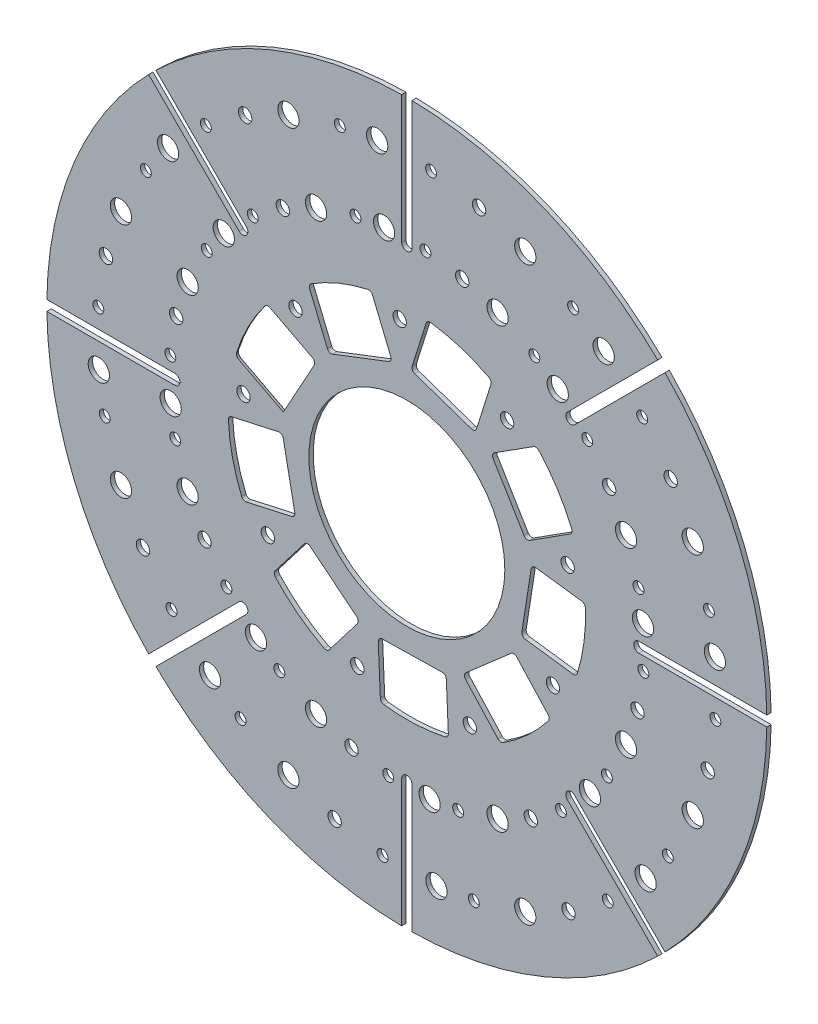
from build123d import *

# Parameters (mm, degrees)
ESBO_O1_R                = 174.5
ESBO_O1_R_2              = 47.5
RESSALTO_EXTRUS_O1_DEPTH = 2.1
ESBO_O3_R                = 5.15
ESBO_O3_R_2              = 2.65
ESBO_O3_R_3              = 3.25
CORTE_EXTRUS_O2_DEPTH    = 247.789201547
CORTE_EXTRUS_O3_DEPTH    = 247.789201547
ESBO_O6_R                = 3.25
CORTE_EXTRUS_O4_DEPTH    = 247.76387499
CORTE_EXTRUS_O5_DEPTH    = 247.76387499
FILETE1_R                = 2


with BuildPart() as part:
    # Esboço1 → Ressalto-extrusão1 (new body)
    with BuildSketch(Plane.XY):
        Circle(ESBO_O1_R)
        Circle(ESBO_O1_R_2, mode=Mode.SUBTRACT)
    extrude(amount=RESSALTO_EXTRUS_O1_DEPTH)

    # Esboço3 → Corte-extrusão2 (cut, through all)
    with BuildSketch(Plane.XY.offset(2.1)):
        with Locations((-138.581929877, 57.402514855)):
            Circle(ESBO_O3_R)
        with Locations((-106.246146239, 44.008594722)):
            Circle(ESBO_O3_R)
        with Locations((-126.508716872, 80.594941252)):
            Circle(ESBO_O3_R_2)
        with Locations((-96.990016268, 61.78945496)):
            Circle(ESBO_O3_R_2)
        with Locations((-115.743687508, 95.411733042)):
            Circle(ESBO_O3_R)
        with Locations((-88.73682709, 73.148995332)):
            Circle(ESBO_O3_R)
        with Locations((-145.85548806, 35.016804578)):
            Circle(ESBO_O3_R_3)
        with Locations((-111.822540846, 26.846216843)):
            Circle(ESBO_O3_R_3)
        with Locations((-114.645493379, 9.022796009)):
            Circle(ESBO_O3_R_2)
        with Locations((-149.53760006, 11.768864359)):
            Circle(ESBO_O3_R_2)
        with Locations((-57.402514855, 138.581929877)):
            Circle(ESBO_O3_R)
        with Locations((-44.008594722, 106.246146239)):
            Circle(ESBO_O3_R)
        with Locations((-32.465942091, 146.444401068)):
            Circle(ESBO_O3_R_2)
        with Locations((-24.890555603, 112.274040819)):
            Circle(ESBO_O3_R_2)
        with Locations((-14.376862878, 149.309429755)):
            Circle(ESBO_O3_R)
        with Locations((-11.02226154, 114.470562812)):
            Circle(ESBO_O3_R)
        with Locations((-78.374784707, 127.896024653)):
            Circle(ESBO_O3_R_3)
        with Locations((-60.087334942, 98.053618901)):
            Circle(ESBO_O3_R_3)
        with Locations((-74.686525558, 87.446686044)):
            Circle(ESBO_O3_R_2)
        with Locations((-97.41720725, 114.06089484)):
            Circle(ESBO_O3_R_2)
        with Locations((57.402514855, 138.581929877)):
            Circle(ESBO_O3_R)
        with Locations((44.008594722, 106.246146239)):
            Circle(ESBO_O3_R)
        with Locations((80.594941252, 126.508716872)):
            Circle(ESBO_O3_R_2)
        with Locations((61.78945496, 96.990016268)):
            Circle(ESBO_O3_R_2)
        with Locations((95.411733042, 115.743687508)):
            Circle(ESBO_O3_R)
        with Locations((73.148995332, 88.73682709)):
            Circle(ESBO_O3_R)
        with Locations((35.016804578, 145.85548806)):
            Circle(ESBO_O3_R_3)
        with Locations((26.846216843, 111.822540846)):
            Circle(ESBO_O3_R_3)
        with Locations((9.022796009, 114.645493379)):
            Circle(ESBO_O3_R_2)
        with Locations((11.768864359, 149.53760006)):
            Circle(ESBO_O3_R_2)
        with Locations((138.581929877, 57.402514855)):
            Circle(ESBO_O3_R)
        with Locations((106.246146239, 44.008594722)):
            Circle(ESBO_O3_R)
        with Locations((146.444401068, 32.465942091)):
            Circle(ESBO_O3_R_2)
        with Locations((112.274040819, 24.890555603)):
            Circle(ESBO_O3_R_2)
        with Locations((149.309429755, 14.376862878)):
            Circle(ESBO_O3_R)
        with Locations((114.470562812, 11.02226154)):
            Circle(ESBO_O3_R)
        with Locations((127.896024653, 78.374784707)):
            Circle(ESBO_O3_R_3)
        with Locations((98.053618901, 60.087334942)):
            Circle(ESBO_O3_R_3)
        with Locations((87.446686044, 74.686525558)):
            Circle(ESBO_O3_R_2)
        with Locations((114.06089484, 97.41720725)):
            Circle(ESBO_O3_R_2)
        with Locations((138.581929877, -57.402514855)):
            Circle(ESBO_O3_R)
        with Locations((106.246146239, -44.008594722)):
            Circle(ESBO_O3_R)
        with Locations((126.508716872, -80.594941252)):
            Circle(ESBO_O3_R_2)
        with Locations((96.990016268, -61.78945496)):
            Circle(ESBO_O3_R_2)
        with Locations((115.743687508, -95.411733042)):
            Circle(ESBO_O3_R)
        with Locations((88.73682709, -73.148995332)):
            Circle(ESBO_O3_R)
        with Locations((145.85548806, -35.016804578)):
            Circle(ESBO_O3_R_3)
        with Locations((111.822540846, -26.846216843)):
            Circle(ESBO_O3_R_3)
        with Locations((114.645493379, -9.022796009)):
            Circle(ESBO_O3_R_2)
        with Locations((149.53760006, -11.768864359)):
            Circle(ESBO_O3_R_2)
        with Locations((57.402514855, -138.581929877)):
            Circle(ESBO_O3_R)
        with Locations((44.008594722, -106.246146239)):
            Circle(ESBO_O3_R)
        with Locations((32.465942091, -146.444401068)):
            Circle(ESBO_O3_R_2)
        with Locations((24.890555603, -112.274040819)):
            Circle(ESBO_O3_R_2)
        with Locations((14.376862878, -149.309429755)):
            Circle(ESBO_O3_R)
        with Locations((11.02226154, -114.470562812)):
            Circle(ESBO_O3_R)
        with Locations((78.374784707, -127.896024653)):
            Circle(ESBO_O3_R_3)
        with Locations((60.087334942, -98.053618901)):
            Circle(ESBO_O3_R_3)
        with Locations((74.686525558, -87.446686044)):
            Circle(ESBO_O3_R_2)
        with Locations((97.41720725, -114.06089484)):
            Circle(ESBO_O3_R_2)
        with Locations((-57.402514855, -138.581929877)):
            Circle(ESBO_O3_R)
        with Locations((-44.008594722, -106.246146239)):
            Circle(ESBO_O3_R)
        with Locations((-80.594941252, -126.508716872)):
            Circle(ESBO_O3_R_2)
        with Locations((-61.78945496, -96.990016268)):
            Circle(ESBO_O3_R_2)
        with Locations((-95.411733042, -115.743687508)):
            Circle(ESBO_O3_R)
        with Locations((-73.148995332, -88.73682709)):
            Circle(ESBO_O3_R)
        with Locations((-35.016804578, -145.85548806)):
            Circle(ESBO_O3_R_3)
        with Locations((-26.846216843, -111.822540846)):
            Circle(ESBO_O3_R_3)
        with Locations((-9.022796009, -114.645493379)):
            Circle(ESBO_O3_R_2)
        with Locations((-11.768864359, -149.53760006)):
            Circle(ESBO_O3_R_2)
        with Locations((-138.581929877, -57.402514855)):
            Circle(ESBO_O3_R)
        with Locations((-106.246146239, -44.008594722)):
            Circle(ESBO_O3_R)
        with Locations((-146.444401068, -32.465942091)):
            Circle(ESBO_O3_R_2)
        with Locations((-112.274040819, -24.890555603)):
            Circle(ESBO_O3_R_2)
        with Locations((-149.309429755, -14.376862878)):
            Circle(ESBO_O3_R)
        with Locations((-114.470562812, -11.02226154)):
            Circle(ESBO_O3_R)
        with Locations((-127.896024653, -78.374784707)):
            Circle(ESBO_O3_R_3)
        with Locations((-98.053618901, -60.087334942)):
            Circle(ESBO_O3_R_3)
        with Locations((-87.446686044, -74.686525558)):
            Circle(ESBO_O3_R_2)
        with Locations((-114.06089484, -97.41720725)):
            Circle(ESBO_O3_R_2)
    extrude(amount=-CORTE_EXTRUS_O2_DEPTH, mode=Mode.SUBTRACT)

    # Esboço2 → Corte-extrusão3 (cut, through all)
    with BuildSketch(Plane.XY.offset(2.1)):
        with BuildLine():
            Line((-2.5, 239.122256025), (2.5, 239.122256025))
            Line((2.5, 239.122256025), (2.5, 112.5))
            ThreePointArc((2.5, 112.5), (0, 110), (-2.5, 112.5))
            Line((-2.5, 112.5), (-2.5, 239.122256025))
        make_face()
        with BuildLine():
            Line((167.317201815, 170.852735721), (170.852735721, 167.317201815))
            Line((170.852735721, 167.317201815), (81.317279836, 77.781745931))
            ThreePointArc((81.317279836, 77.781745931), (77.781745931, 77.781745931), (77.781745931, 81.317279836))
            Line((77.781745931, 81.317279836), (167.317201815, 170.852735721))
        make_face()
        with BuildLine():
            Line((239.122256025, 2.5), (239.122256025, -2.5))
            Line((239.122256025, -2.5), (112.5, -2.5))
            ThreePointArc((112.5, -2.5), (110, 0), (112.5, 2.5))
            Line((112.5, 2.5), (239.122256025, 2.5))
        make_face()
        with BuildLine():
            Line((170.852735721, -167.317201815), (167.317201815, -170.852735721))
            Line((167.317201815, -170.852735721), (77.781745931, -81.317279836))
            ThreePointArc((77.781745931, -81.317279836), (77.781745931, -77.781745931), (81.317279836, -77.781745931))
            Line((81.317279836, -77.781745931), (170.852735721, -167.317201815))
        make_face()
        with BuildLine():
            Line((2.5, -239.122256025), (-2.5, -239.122256025))
            Line((-2.5, -239.122256025), (-2.5, -112.5))
            ThreePointArc((-2.5, -112.5), (0, -110), (2.5, -112.5))
            Line((2.5, -112.5), (2.5, -239.122256025))
        make_face()
        with BuildLine():
            Line((-167.317201815, -170.852735721), (-170.852735721, -167.317201815))
            Line((-170.852735721, -167.317201815), (-81.317279836, -77.781745931))
            ThreePointArc((-81.317279836, -77.781745931), (-77.781745931, -77.781745931), (-77.781745931, -81.317279836))
            Line((-77.781745931, -81.317279836), (-167.317201815, -170.852735721))
        make_face()
        with BuildLine():
            Line((-239.122256025, -2.5), (-239.122256025, 2.5))
            Line((-239.122256025, 2.5), (-112.5, 2.5))
            ThreePointArc((-112.5, 2.5), (-110, 0), (-112.5, -2.5))
            Line((-112.5, -2.5), (-239.122256025, -2.5))
        make_face()
        with BuildLine():
            Line((-170.852735721, 167.317201815), (-167.317201815, 170.852735721))
            Line((-167.317201815, 170.852735721), (-77.781745931, 81.317279836))
            ThreePointArc((-77.781745931, 81.317279836), (-77.781745931, 77.781745931), (-81.317279836, 77.781745931))
            Line((-81.317279836, 77.781745931), (-170.852735721, 167.317201815))
        make_face()
    extrude(amount=-CORTE_EXTRUS_O3_DEPTH, mode=Mode.SUBTRACT)

    # Esboço6 → Corte-extrusão4 (cut, through all)
    with BuildSketch(Plane.XY.offset(2.1)):
        with Locations((-3.483008081, 79.774000493)):
            Circle(ESBO_O6_R)
        with Locations((48.609600106, 63.349264222)):
            Circle(ESBO_O6_R)
        with Locations((77.957236169, 17.282703173)):
            Circle(ESBO_O6_R)
        with Locations((70.827815029, -36.870626767)):
            Circle(ESBO_O6_R)
        with Locations((30.557272074, -73.771780671)):
            Circle(ESBO_O6_R)
        with Locations((-24.01135809, -76.154298517)):
            Circle(ESBO_O6_R)
        with Locations((-67.344806948, -42.903373726)):
            Circle(ESBO_O6_R)
        with Locations((-79.166872181, 10.422516449)):
            Circle(ESBO_O6_R)
        with Locations((-53.945878078, 58.871595344)):
            Circle(ESBO_O6_R)
    extrude(amount=-CORTE_EXTRUS_O4_DEPTH, mode=Mode.SUBTRACT)

    # Esboço7 → Corte-extrusão5 (cut, through all)
    with BuildSketch(Plane.XY.offset(2.1)):
        with BuildLine():
            Line((-37.781699587, 48.109559853), (-6.992261999, 59.984345451))
            Line((-6.992261999, 59.984345451), (-17.294262305, 84.855574309))
            ThreePointArc((-17.294262305, 84.855574309), (-33.140385243, 80.007967515), (-47.773061864, 72.230842167))
            Line((-47.773061864, 72.230842167), (-37.781699587, 48.109559853))
        make_face()
        with BuildLine():
            Line((1.98176796, 61.139669354), (33.200810582, 50.445213884))
            Line((33.200810582, 50.445213884), (41.295938242, 76.119678696))
            ThreePointArc((41.295938242, 76.119678696), (26.041122237, 82.591887935), (9.832801811, 86.039967507))
            Line((9.832801811, 86.039967507), (1.98176796, 61.139669354))
        make_face()
        with BuildLine():
            Line((40.817944254, 45.561848072), (57.858854906, 17.302206104))
            Line((57.858854906, 17.302206104), (80.563310332, 31.766539444))
            ThreePointArc((80.563310332, 31.766539444), (73.037699207, 46.530146083), (62.837788238, 59.590035822))
            Line((62.837788238, 59.590035822), (40.817944254, 45.561848072))
        make_face()
        with BuildLine():
            Line((60.554950791, 8.665131714), (55.44409799, -23.936696204))
            Line((55.44409799, -23.936696204), (82.134214157, -27.450516659))
            ThreePointArc((82.134214157, -27.450516659), (85.859124995, -11.303568246), (86.440275185, 5.257264107))
            Line((86.440275185, 5.257264107), (60.554950791, 8.665131714))
        make_face()
        with BuildLine():
            Line((51.957622859, -32.286096075), (27.086431432, -53.975352332))
            Line((27.086431432, -53.975352332), (45.273606357, -73.823170938))
            ThreePointArc((45.273606357, -73.823170938), (58.50611198, -63.848217368), (69.596396696, -51.535439912))
            Line((69.596396696, -51.535439912), (51.957622859, -32.286096075))
        make_face()
        with BuildLine():
            Line((19.048745747, -58.130300691), (-13.945277425, -58.758341234))
            Line((-13.945277425, -58.758341234), (-12.771025017, -85.653143083))
            ThreePointArc((-12.771025017, -85.653143083), (3.777438946, -86.517575989), (20.187590715, -84.214138843))
            Line((20.187590715, -84.214138843), (19.048745747, -58.130300691))
        make_face()
        with BuildLine():
            Line((-22.773251204, -56.774691567), (-48.45183599, -36.047649247))
            Line((-48.45183599, -36.047649247), (-64.839951852, -57.405057651))
            ThreePointArc((-64.839951852, -57.405057651), (-52.718739752, -68.704399269), (-38.667213321, -77.488106274))
            Line((-38.667213321, -77.488106274), (-22.773251204, -56.774691567))
        make_face()
        with BuildLine():
            Line((-53.93939082, -28.853573279), (-60.287242014, 3.530138448))
            Line((-60.287242014, 3.530138448), (-86.569544599, -2.296507757))
            ThreePointArc((-86.569544599, -2.296507757), (-84.547234217, -18.743670567), (-79.429198507, -34.504527595))
            Line((-79.429198507, -34.504527595), (-53.93939082, -28.853573279))
        make_face()
        with BuildLine():
            Line((-59.866690001, 12.568452618), (-43.91357748, 41.45613513))
            Line((-43.91357748, 41.45613513), (-67.792285315, 53.886603639))
            ThreePointArc((-67.792285315, 53.886603639), (-76.815138153, 39.987429906), (-83.025378954, 24.624103021))
            Line((-83.025378954, 24.624103021), (-59.866690001, 12.568452618))
        make_face()
    extrude(amount=-CORTE_EXTRUS_O5_DEPTH, mode=Mode.SUBTRACT)

    # Filete1
    filete1_edges = [part.edges().sort_by_distance(p)[0] for p in [
        (-71.446034478, 18.59627782, 0),
        (-76.815138153, 39.987429906, 0),
        (-55.852931398, 47.671369384, 0),
        (-22.773251204, -56.774691567, 1.05),
        (-38.667213321, -77.488106274, 1.05),
        (-64.839951852, -57.405057651, 1.05),
        (-48.45183599, -36.047649247, 1.05),
        (20.187590715, -84.214138843, 1.05),
        (-12.771025017, -85.653143083, 1.05),
        (-13.945277425, -58.758341234, 1.05),
        (19.048745747, -58.130300691, 1.05),
        (51.957622859, -32.286096075, 1.05),
        (27.086431432, -53.975352332, 1.05),
        (45.273606357, -73.823170938, 1.05),
        (69.596396696, -51.535439912, 1.05),
        (82.134214157, -27.450516659, 1.05),
        (55.44409799, -23.936696204, 1.05),
        (60.554950791, 8.665131714, 1.05),
        (86.440275185, 5.257264107, 1.05),
        (62.837788238, 59.590035822, 1.05),
        (40.817944254, 45.561848072, 1.05),
        (57.858854906, 17.302206104, 1.05),
        (80.563310332, 31.766539444, 1.05),
        (33.200810582, 50.445213884, 1.05),
        (1.98176796, 61.139669354, 1.05),
        (9.832801811, 86.039967507, 1.05),
        (41.295938242, 76.119678696, 1.05),
        (-6.992261999, 59.984345451, 1.05),
        (-37.781699587, 48.109559853, 1.05),
        (-47.773061864, 72.230842167, 1.05),
        (-17.294262305, 84.855574309, 1.05),
        (-43.91357748, 41.45613513, 1.05),
        (-67.792285315, 53.886603639, 1.05),
        (-83.025378954, 24.624103021, 1.05),
        (-51.890133741, 27.012293874, 0),
        (-53.93939082, -28.853573279, 1.05),
        (-79.429198507, -34.504527595, 1.05),
        (-86.569544599, -2.296507757, 1.05),
        (-60.287242014, 3.530138448, 1.05),
    ]]
    fillet(filete1_edges, radius=FILETE1_R)


solid = part.part
